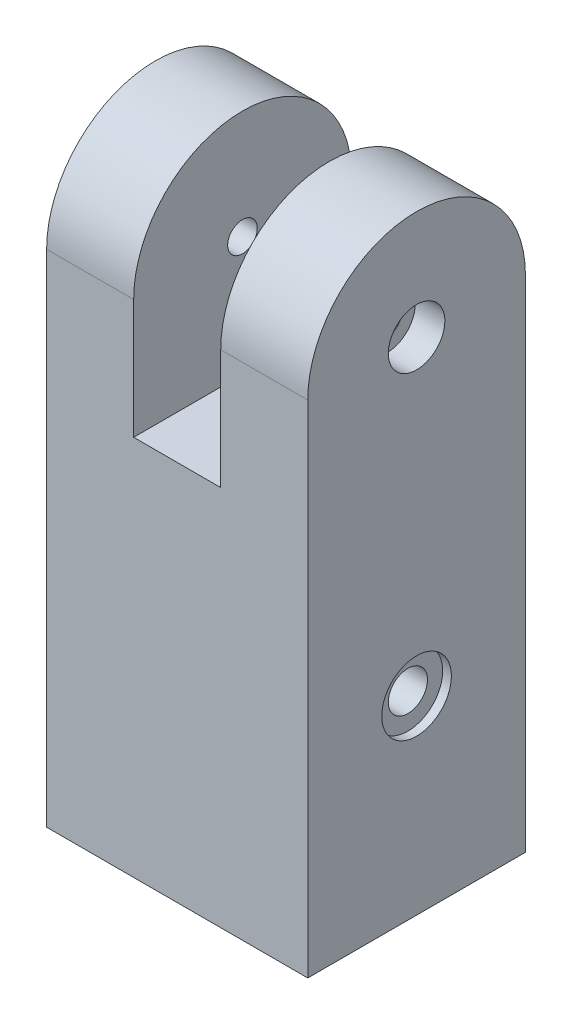
from build123d import *

# Parameters (mm, degrees)
BOSS_EXTRU_1_DEPTH                                 = 15
CHAMBRAGE_POUR_VIS_T_TE_HEXAGONALE_M31_D           = 3.4
CHAMBRAGE_POUR_VIS_T_TE_HEXAGONALE_M31_CBORE_D     = 6.5
CHAMBRAGE_POUR_VIS_T_TE_HEXAGONALE_M31_CBORE_DEPTH = 3.4
ENL_V_MAT_EXTRU_2_REACH                            = 51.74
ESQUISSE3_W                                        = 10
ESQUISSE3_H                                        = 26.208058997
ESQUISSE2_W                                        = 20.4
ESQUISSE2_H                                        = 20.4
ENL_V_MAT_EXTRU_1_DEPTH                            = 38.791941003
CHAMBRAGE_POUR_VIS_T_TE_HEXAGONALE_M42_D           = 4.5
CHAMBRAGE_POUR_VIS_T_TE_HEXAGONALE_M42_DEPTH       = 4.8
CHAMBRAGE_POUR_VIS_T_TE_HEXAGONALE_M42_CBORE_D     = 8
CHAMBRAGE_POUR_VIS_T_TE_HEXAGONALE_M42_CBORE_DEPTH = 1
CHAMBRAGE_POUR_VIS_T_TE_HEXAGONALE_M43_D           = 4.5
CHAMBRAGE_POUR_VIS_T_TE_HEXAGONALE_M43_CBORE_D     = 8
CHAMBRAGE_POUR_VIS_T_TE_HEXAGONALE_M43_CBORE_DEPTH = 4.4


with BuildPart() as part:
    # Esquisse1 → Boss.-Extru.1 (new, symmetric)
    with BuildSketch(Plane(origin=(0, 0, 0), x_dir=(0, 0, -1), z_dir=(1, 0, 0))):
        with BuildLine():
            Line((-12.5, -40.299852287), (-12.5, 17.200147713))
            ThreePointArc((-12.5, 17.200147713), (0, 29.700147713), (12.5, 17.200147713))
            Line((12.5, 17.200147713), (12.5, -40.299852287))
            Line((12.5, -40.299852287), (-12.5, -40.299852287))
        make_face()
    extrude(amount=BOSS_EXTRU_1_DEPTH, both=True)

    # Chambrage pour vis à tête hexagonale M31 (through all)
    with Locations(Plane(origin=(15, 0, 0), x_dir=(0, 0, -1), z_dir=(1, 0, 0))):
        with Locations((0, 17.200147713)):
            CounterBoreHole(CHAMBRAGE_POUR_VIS_T_TE_HEXAGONALE_M31_D / 2, CHAMBRAGE_POUR_VIS_T_TE_HEXAGONALE_M31_CBORE_D / 2, CHAMBRAGE_POUR_VIS_T_TE_HEXAGONALE_M31_CBORE_DEPTH)

    # Esquisse3 → Enlèv. mat.-Extru.2 (cut, up to next)
    with BuildSketch(Plane(origin=(0, 0, -12.5), x_dir=(-1, 0, 0), z_dir=(0, 0, -1)), mode=Mode.PRIVATE) as enl_v_mat_extru_2_sk1:
        with Locations((0, 16.596118215)):
            Rectangle(ESQUISSE3_W, ESQUISSE3_H)
    enl_v_mat_extru_2_tool1 = extrude(enl_v_mat_extru_2_sk1.sketch, amount=-ENL_V_MAT_EXTRU_2_REACH, mode=Mode.PRIVATE) & part.part
    add(enl_v_mat_extru_2_tool1.solids().sort_by_distance((0, 16.596118, -12.5))[0], mode=Mode.SUBTRACT)

    # Esquisse2 → Enlèv. mat.-Extru.1 (cut)
    with BuildSketch(Plane.XZ.offset(40.299852287)):
        Rectangle(ESQUISSE2_W, ESQUISSE2_H)
    extrude(amount=-ENL_V_MAT_EXTRU_1_DEPTH, mode=Mode.SUBTRACT)

    # Chambrage pour vis à tête hexagonale M42
    with Locations(Plane.ZY.offset(15)):
        with Locations((0, -18.495042181)):
            chambrage_pour_vis_t_te_hexagonale_m42 = CounterBoreHole(CHAMBRAGE_POUR_VIS_T_TE_HEXAGONALE_M42_D / 2, CHAMBRAGE_POUR_VIS_T_TE_HEXAGONALE_M42_CBORE_D / 2, CHAMBRAGE_POUR_VIS_T_TE_HEXAGONALE_M42_CBORE_DEPTH, depth=CHAMBRAGE_POUR_VIS_T_TE_HEXAGONALE_M42_DEPTH)

    # Chambrage pour vis à tête hexagonale M43 (through all)
    with Locations(Plane(origin=(0, 3.492088716, 0), x_dir=(1, 0, 0), z_dir=(0, 1, 0))):
        with Locations((0, 0)):
            CounterBoreHole(CHAMBRAGE_POUR_VIS_T_TE_HEXAGONALE_M43_D / 2, CHAMBRAGE_POUR_VIS_T_TE_HEXAGONALE_M43_CBORE_D / 2, CHAMBRAGE_POUR_VIS_T_TE_HEXAGONALE_M43_CBORE_DEPTH)

    # Symétrie1: Chambrage pour vis à tête hexagonale M42 across plane
    add(chambrage_pour_vis_t_te_hexagonale_m42.mirror(Plane(origin=(0, 0, 0), x_dir=(0, 0, 1), z_dir=(1, 0, 0))), mode=Mode.SUBTRACT)


solid = part.part
